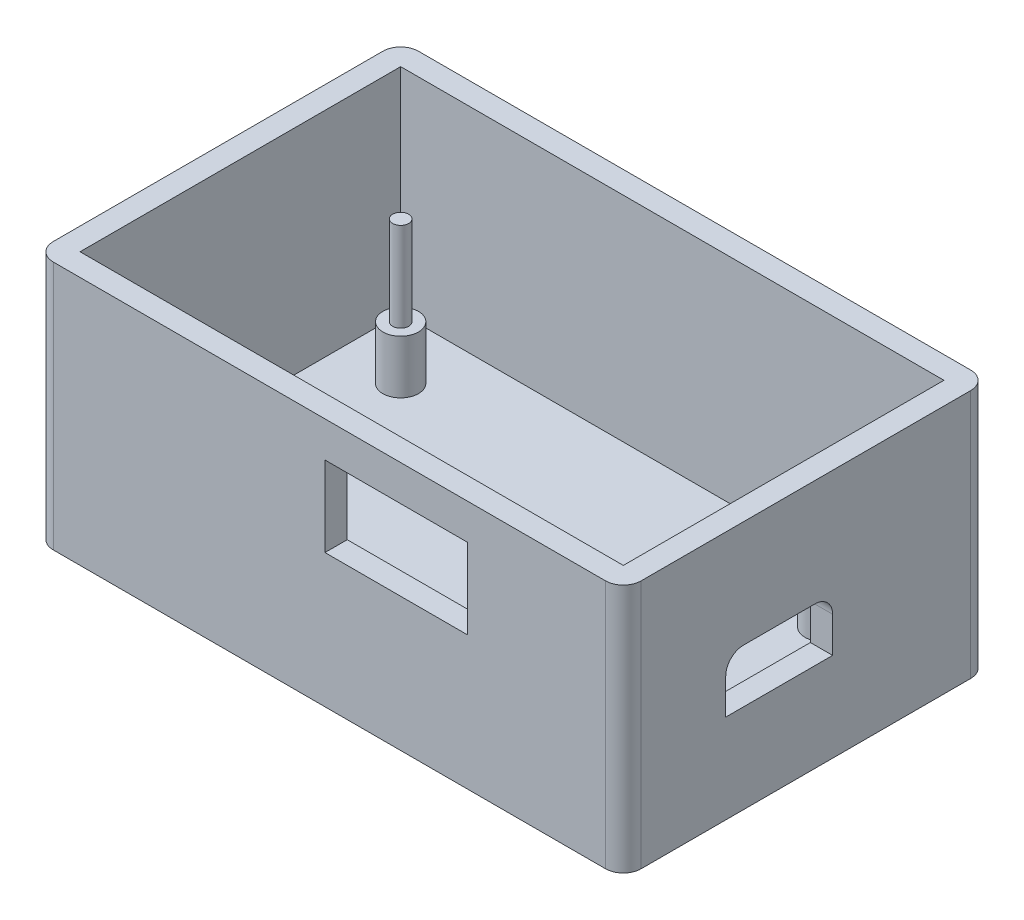
from build123d import *

# Parameters (mm, degrees)
SKETCH1_W           = 66
SKETCH1_H           = 41
BOSS_EXTRUDE1_DEPTH = 4
SKETCH3_W           = 66
SKETCH3_H           = 41
SKETCH3_W_2         = 61
SKETCH3_H_2         = 36
BOSS_EXTRUDE3_DEPTH = 24
SKETCH2_R           = 0.9
BOSS_EXTRUDE4_DEPTH = 16
SKETCH4_R           = 2
BOSS_EXTRUDE5_DEPTH = 6
SKETCH5_W           = 12
SKETCH5_H           = 6
CUT_EXTRUDE1_DEPTH  = 6
FILLET2_R           = 2
FILLET3_R           = 2
SKETCH6_W           = 16
SKETCH6_H           = 9
CUT_EXTRUDE2_DEPTH  = 6


with BuildPart() as part:
    # Sketch1 → Boss-Extrude1 (new body)
    with BuildSketch(Plane(origin=(0, 0, 0), x_dir=(1, 0, 0), z_dir=(0, 1, 0))):
        with Locations((25.5, 13)):
            Rectangle(SKETCH1_W, SKETCH1_H)
    extrude(amount=BOSS_EXTRUDE1_DEPTH)

    # Sketch3 → Boss-Extrude3 (add)
    with BuildSketch(Plane(origin=(0, 4, 0), x_dir=(1, 0, 0), z_dir=(0, 1, 0))):
        with Locations((25.5, 13)):
            Rectangle(SKETCH3_W, SKETCH3_H)
        with Locations((25.5, 13)):
            Rectangle(SKETCH3_W_2, SKETCH3_H_2, mode=Mode.SUBTRACT)
    extrude(amount=BOSS_EXTRUDE3_DEPTH)

    # Sketch2 → Boss-Extrude4 (add)
    with BuildSketch(Plane(origin=(0, 4, 0), x_dir=(1, 0, 0), z_dir=(0, 1, 0))):
        with Locations(Location((1.8, 24.2, 0), (0, 0, 270))):
            Circle(SKETCH2_R)
        with Locations(Location((1.8, 1.8, 0), (0, 0, 90))):
            Circle(SKETCH2_R)
        with Locations(Location((49.2, 1.8, 0), (0, 0, 270))):
            Circle(SKETCH2_R)
        with Locations(Location((49.2, 24.2, 0), (0, 0, 90))):
            Circle(SKETCH2_R)
    extrude(amount=BOSS_EXTRUDE4_DEPTH)

    # Sketch4 → Boss-Extrude5 (add)
    with BuildSketch(Plane(origin=(0, 4, 0), x_dir=(1, 0, 0), z_dir=(0, 1, 0))):
        with Locations(Location((1.8, 24.2, 0), (0, 0, 270))):
            Circle(SKETCH4_R)
        with Locations(Location((1.8, 1.8, 0), (0, 0, 90))):
            Circle(SKETCH4_R)
        with Locations(Location((49.2, 1.8, 0), (0, 0, 270))):
            Circle(SKETCH4_R)
        with Locations(Location((49.2, 24.2, 0), (0, 0, 90))):
            Circle(SKETCH4_R)
    extrude(amount=BOSS_EXTRUDE5_DEPTH)

    # Sketch5 → Cut-Extrude1 (cut)
    with BuildSketch(Plane(origin=(58.5, 0, 0), x_dir=(0, 0, -1), z_dir=(1, 0, 0))):
        with Locations((10, 13)):
            Rectangle(SKETCH5_W, SKETCH5_H)
    extrude(amount=-CUT_EXTRUDE1_DEPTH, mode=Mode.SUBTRACT)

    # Fillet2
    fillet2_edges = [part.edges().sort_by_distance(p)[0] for p in [
        (-7.5, 14, 7.5),
        (-7.5, 14, -33.5),
        (58.5, 14, -33.5),
        (58.5, 14, 7.5),
    ]]
    fillet(fillet2_edges, radius=FILLET2_R)

    # Fillet3
    fillet3_edges = [part.edges().sort_by_distance(p)[0] for p in [
        (57.25, 16, -4),
        (57.25, 16, -16),
    ]]
    fillet(fillet3_edges, radius=FILLET3_R)

    # Sketch6 → Cut-Extrude2 (cut)
    with BuildSketch(Plane.XY.offset(7.5)):
        with Locations((33, 19.5)):
            Rectangle(SKETCH6_W, SKETCH6_H)
    extrude(amount=-CUT_EXTRUDE2_DEPTH, mode=Mode.SUBTRACT)


solid = part.part
